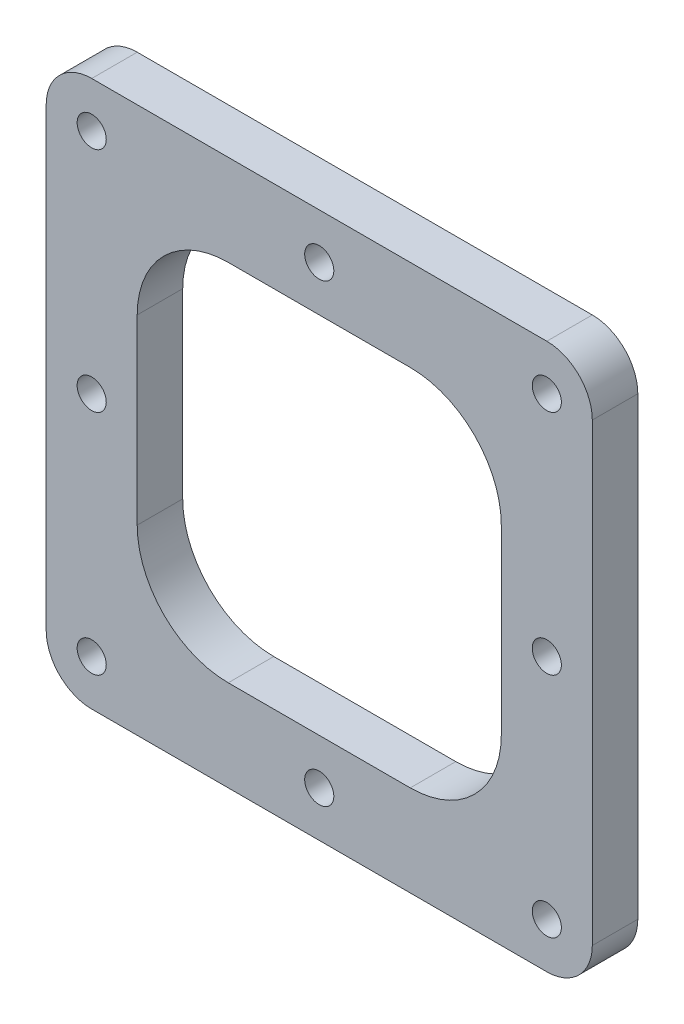
from build123d import *

# Parameters (mm, degrees)
EXTRUDE_1_DEPTH     = 5
SKETCH_2_R          = 1.6
SKETCH_2_W          = 40
SKETCH_2_H          = 40
CUT_EXTRUDE_1_DEPTH = 86
FILLET_1_R          = 10


with BuildPart() as part:
    # 草图1 → 凸台-拉伸1 (new body)
    with BuildSketch(Plane.XY):
        with BuildLine():
            Line((5, 0), (55, 0))
            ThreePointArc((55, 0), (58.535533906, 1.464466094), (60, 5))
            Line((60, 5), (60, 55))
            ThreePointArc((60, 55), (58.535533906, 58.535533906), (55, 60))
            Line((55, 60), (5, 60))
            ThreePointArc((5, 60), (1.464466094, 58.535533906), (0, 55))
            Line((0, 55), (0, 5))
            ThreePointArc((0, 5), (1.464466094, 1.464466094), (5, 0))
        make_face()
    extrude(amount=EXTRUDE_1_DEPTH)

    # 草图2 → 切除-拉伸1 (cut, through all)
    with BuildSketch(Plane.XY.offset(5)):
        with Locations((5, 55)):
            Circle(SKETCH_2_R)
        with Locations((30, 55)):
            Circle(SKETCH_2_R)
        with Locations((55, 55)):
            Circle(SKETCH_2_R)
        with Locations((55, 30)):
            Circle(SKETCH_2_R)
        with Locations((30, 5)):
            Circle(SKETCH_2_R)
        with Locations((55, 5)):
            Circle(SKETCH_2_R)
        with Locations((5, 30)):
            Circle(SKETCH_2_R)
        with Locations((5, 5)):
            Circle(SKETCH_2_R)
        with Locations((30, 30)):
            Rectangle(SKETCH_2_W, SKETCH_2_H)
    extrude(amount=-CUT_EXTRUDE_1_DEPTH, mode=Mode.SUBTRACT)

    # 圆角1
    fillet_1_edges = [part.edges().sort_by_distance(p)[0] for p in [
        (10, 10, 2.5),
        (10, 50, 2.5),
        (50, 50, 2.5),
        (50, 10, 2.5),
    ]]
    fillet(fillet_1_edges, radius=FILLET_1_R)


solid = part.part
